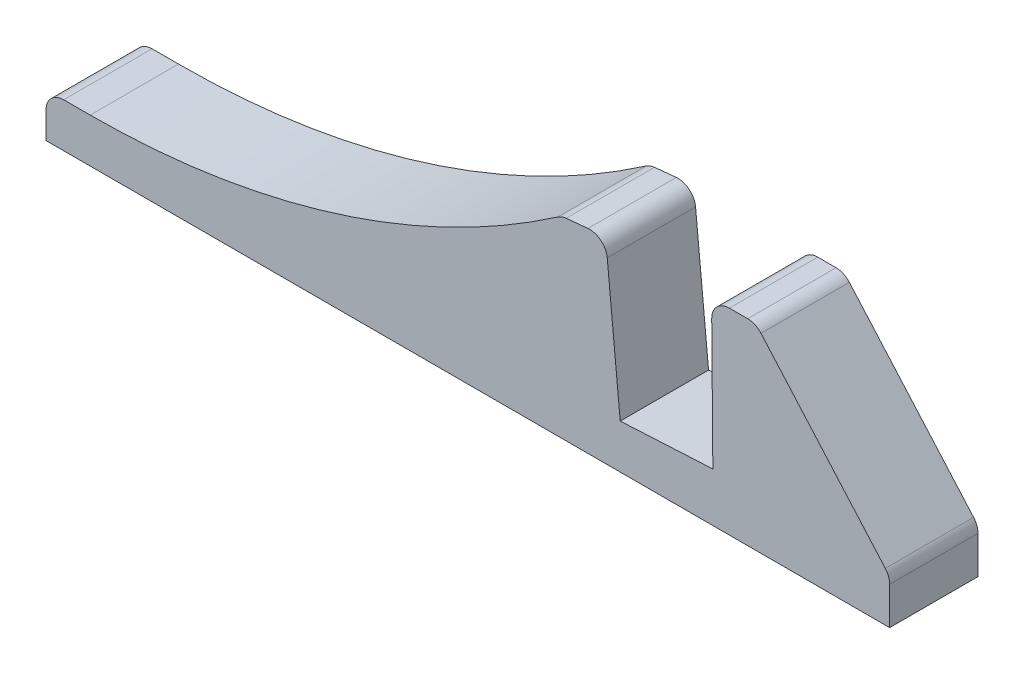
from build123d import *

# Parameters (mm, degrees)
BOSS_EXTRU_1_DEPTH = 10
CONG_1_R           = 2


with BuildPart() as part:
    # Esquisse1 → Boss.-Extru.1 (new body)
    with BuildSketch(Plane.XY):
        with BuildLine():
            Line((0, 0), (95.5, 0))
            Line((95.5, 0), (95.5, 5))
            Line((95.5, 5), (80.339854507, 22.251465861))
            Line((80.339854507, 22.251465861), (75.339854507, 22.251465861))
            Line((75.339854507, 22.251465861), (75.485610115, 5.549527541))
            Line((75.485610115, 5.549527541), (65, 5))
            Line((65, 5), (63.338872772, 22.251465861))
            Line((63.338872772, 22.251465861), (58.36189178, 21.772237099))
            ThreePointArc((58.36189178, 21.772237099), (32.967836132, 9.291799024), (5, 5))
            Line((5, 5), (0, 5))
            Line((0, 5), (0, 0))
        make_face()
    extrude(amount=BOSS_EXTRU_1_DEPTH)

    # Congé1
    cong_1_edges = [part.edges().sort_by_distance(p)[0] for p in [
        (0, 5, 5),
        (58.36189178, 21.772237099, 5),
        (63.338872772, 22.251465861, 5),
        (75.339854507, 22.251465861, 5),
        (80.339854507, 22.251465861, 5),
        (95.5, 5, 5),
    ]]
    fillet(cong_1_edges, radius=CONG_1_R)


solid = part.part
